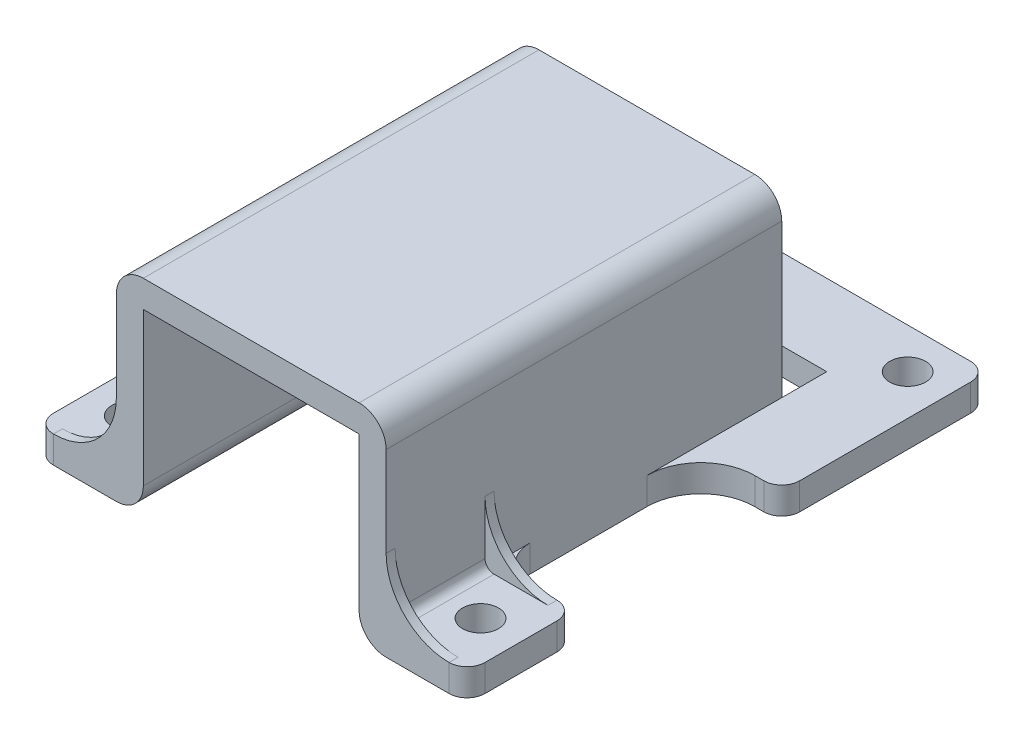
from build123d import *

# Parameters (mm, degrees)
BOSS_EXTRUDE1_DEPTH = 22
BOSS_EXTRUDE2_DEPTH = 6
CUT_EXTRUDE1_DEPTH  = 6
FILLET1_R           = 0.5
SKETCH4_R           = 1.000653367
CUT_EXTRUDE2_DEPTH  = 6
SKETCH5_W           = 4.5
SKETCH5_H           = 1.5
BOSS_EXTRUDE3_DEPTH = 4.5
SKETCH7_W           = 4.5
SKETCH7_H           = 1.5
BOSS_EXTRUDE4_DEPTH = 7
SKETCH8_W           = 4.5
SKETCH8_H           = 1.5
BOSS_EXTRUDE5_DEPTH = 17
SKETCH9_R           = 1
CUT_EXTRUDE3_DEPTH  = 17
FILLET2_R           = 1
FILLET3_R           = 3
BOSS_EXTRUDE6_DEPTH = 1.5


with BuildPart() as part:
    # Sketch2 → Boss-Extrude1 (new body)
    with BuildSketch(Plane.XY):
        with BuildLine():
            Line((4.5, 5), (4.5, 0))
            ThreePointArc((4.5, 0), (5.560660172, 0.439339828), (6, 1.5))
            Line((6, 1.5), (6, 10))
            Line((6, 10), (18, 10))
            Line((18, 10), (18, 1.5))
            ThreePointArc((18, 1.5), (18.439339828, 0.439339828), (19.5, 0))
            Line((19.5, 0), (19.5, 5))
            Line((19.5, 5), (19.5, 10))
            ThreePointArc((19.5, 10), (19.060660172, 11.060660172), (18, 11.5))
            Line((18, 11.5), (6, 11.5))
            ThreePointArc((6, 11.5), (4.939339828, 11.060660172), (4.5, 10))
            Line((4.5, 10), (4.5, 5))
        make_face()
    extrude(amount=-BOSS_EXTRUDE1_DEPTH)

    # Sketch2<6> → Boss-Extrude2 (add)
    with BuildSketch(Plane.XY):
        with BuildLine():
            Line((0, 1.5), (0, 0))
            Line((0, 0), (4.5, 0))
            Line((4.5, 0), (4.5, 5))
            ThreePointArc((4.5, 5), (3.474873734, 2.525126266), (1, 1.5))
            Line((1, 1.5), (0, 1.5))
        make_face()
        with BuildLine():
            Line((19.5, 5), (19.5, 0))
            Line((19.5, 0), (24, 0))
            Line((24, 0), (24, 1.5))
            Line((24, 1.5), (23, 1.5))
            ThreePointArc((23, 1.5), (20.525126266, 2.525126266), (19.5, 5))
        make_face()
    extrude(amount=-BOSS_EXTRUDE2_DEPTH)

    # Sketch3 → Cut-Extrude1 (cut)
    with BuildSketch(Plane(origin=(0, 1.5, 0), x_dir=(1, 0, 0), z_dir=(0, 1, 0))):
        Polygon((24, 3), (24, 5.5), (19.5, 5.5), (19.5, 0.5), (24, 0.5), align=None)
        Polygon((0, 3), (0, 0.5), (4.5, 0.5), (4.5, 5.5), (0, 5.5), align=None)
    extrude(amount=CUT_EXTRUDE1_DEPTH, mode=Mode.SUBTRACT)

    # Fillet1
    fillet1_edges = [part.edges().sort_by_distance(p)[0] for p in [
        (19.5, 1.5, -3),
        (4.5, 1.5, -3),
    ]]
    fillet(fillet1_edges, radius=FILLET1_R)

    # Sketch4 → Cut-Extrude2 (cut)
    with BuildSketch(Plane(origin=(0, 1.5, 0), x_dir=(1, 0, 0), z_dir=(0, 1, 0))):
        with Locations((2.25, 3)):
            Circle(SKETCH4_R)
        with Locations((21.75, 3)):
            Circle(SKETCH4_R)
    extrude(amount=-CUT_EXTRUDE2_DEPTH, mode=Mode.SUBTRACT)

    # Sketch5 → Boss-Extrude3 (add)
    with BuildSketch(Plane(origin=(0, 0, -22), x_dir=(-1, 0, 0), z_dir=(0, 0, -1))):
        with Locations((-21.75, 0.75)):
            Rectangle(SKETCH5_W, SKETCH5_H)
        with Locations((-2.25, 0.75)):
            Rectangle(SKETCH5_W, SKETCH5_H)
    extrude(amount=-BOSS_EXTRUDE3_DEPTH)

    # Sketch7 → Boss-Extrude4 (add)
    with BuildSketch(Plane(origin=(0, 0, -22), x_dir=(-1, 0, 0), z_dir=(0, 0, -1))):
        with Locations((-21.75, 0.75)):
            Rectangle(SKETCH7_W, SKETCH7_H)
        with Locations((-2.25, 0.75)):
            Rectangle(SKETCH7_W, SKETCH7_H)
    extrude(amount=BOSS_EXTRUDE4_DEPTH)

    # Sketch8 → Boss-Extrude5 (add)
    with BuildSketch(Plane(origin=(4.5, 0, 0), x_dir=(0, 0, -1), z_dir=(1, 0, 0))):
        with Locations((26.75, 0.75)):
            Rectangle(SKETCH8_W, SKETCH8_H)
    extrude(amount=BOSS_EXTRUDE5_DEPTH)

    # Sketch9 → Cut-Extrude3 (cut)
    with BuildSketch(Plane(origin=(0, 1.5, 0), x_dir=(1, 0, 0), z_dir=(0, 1, 0))):
        with Locations((2.25, 26.75)):
            Circle(SKETCH9_R)
        with Locations((21.75, 26.75)):
            Circle(SKETCH9_R)
    extrude(amount=-CUT_EXTRUDE3_DEPTH, mode=Mode.SUBTRACT)

    # Fillet2
    fillet2_edges = [part.edges().sort_by_distance(p)[0] for p in [
        (24, 0.75, 0),
        (0, 0.75, 0),
        (0, 0.75, -6),
        (24, 0.75, -6),
        (24, 0.75, -17.5),
        (24, 0.75, -29),
        (0, 0.75, -17.5),
        (0, 0.75, -29),
    ]]
    fillet(fillet2_edges, radius=FILLET2_R)

    # Fillet3
    fillet3_edges = [part.edges().sort_by_distance(p)[0] for p in [
        (19.5, 0.75, -17.5),
        (4.5, 0.75, -17.5),
    ]]
    fillet(fillet3_edges, radius=FILLET3_R)

    # Sketch13 → Boss-Extrude6 (add)
    with BuildSketch(Plane.XZ):
        with BuildLine():
            Line((4.5, -8), (4.5, -6))
            Line((4.5, -6), (2.5, -6))
            ThreePointArc((2.5, -6), (3.914213562, -6.585786438), (4.5, -8))
        make_face()
        with BuildLine():
            ThreePointArc((19.5, -8), (20.085786438, -6.585786438), (21.5, -6))
            Line((21.5, -6), (19.5, -6))
            Line((19.5, -6), (19.5, -8))
        make_face()
    extrude(amount=-BOSS_EXTRUDE6_DEPTH)


solid = part.part
